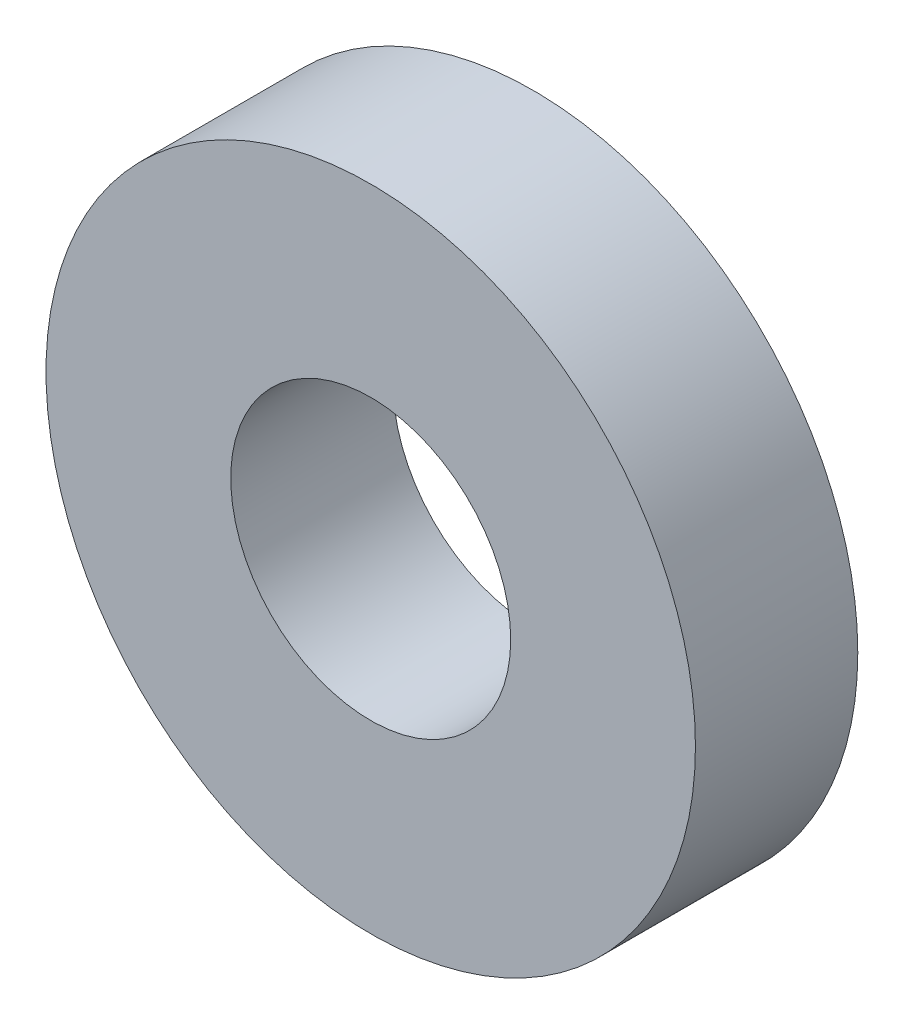
from build123d import *

# Parameters (mm, degrees)
SKETCH1_R           = 6.35
SKETCH1_R_2         = 2.737499986
BOSS_EXTRUDE1_DEPTH = 3.175


with BuildPart() as part:
    # Sketch1 → Boss-Extrude1 (new body)
    with BuildSketch(Plane.XY):
        Circle(SKETCH1_R)
        Circle(SKETCH1_R_2, mode=Mode.SUBTRACT)
    extrude(amount=BOSS_EXTRUDE1_DEPTH)


solid = part.part
